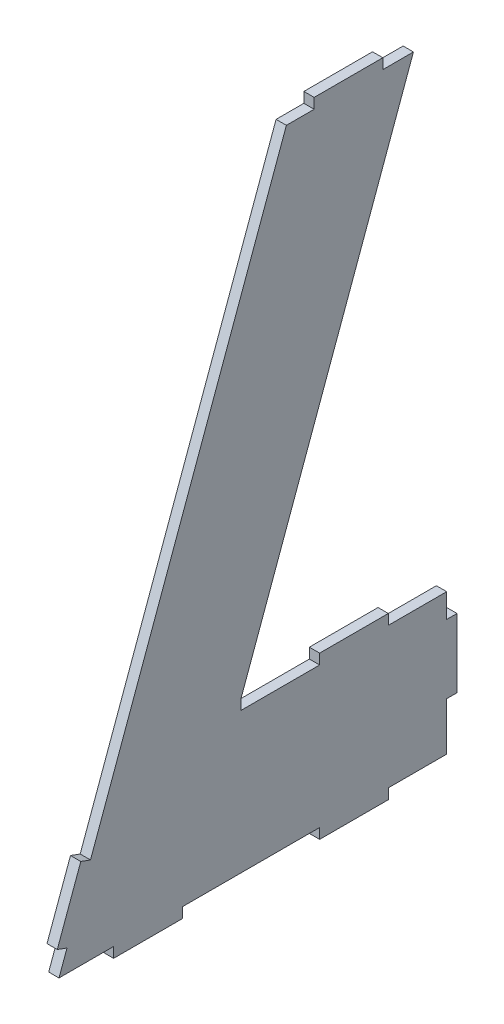
from build123d import *

# Parameters (mm, degrees)
BOSS_EXTRUDE1_DEPTH = 3
CUT_EXTRUDE1_DEPTH  = 267.131484195
SKETCH3_W           = 29.976768642
SKETCH3_H           = 52.268511193
CUT_EXTRUDE2_DEPTH  = 233.651187464
SKETCH5_W           = 11.091910703
SKETCH5_H           = 3
SKETCH5_W_2         = 10
CUT_EXTRUDE4_DEPTH  = 224.001992956
SKETCH6_W           = 20
SKETCH6_H           = 3
CUT_EXTRUDE5_DEPTH  = 224.001992956
SKETCH7_W           = 40
SKETCH7_H           = 3
CUT_EXTRUDE6_DEPTH  = 224.001992956
SKETCH8_W           = 20
SKETCH8_H           = 3
SKETCH8_W_2         = 22.898992834
CUT_EXTRUDE7_DEPTH  = 224.001992956
SKETCH10_W          = 3
SKETCH10_H          = 7
SKETCH10_H_2        = 13.984631039
CUT_EXTRUDE9_DEPTH  = 224.001992956
CUT_EXTRUDE10_REACH = 225.002
SKETCH12_W          = 3
SKETCH12_H          = 20
BOSS_EXTRUDE2_DEPTH = 3


with BuildPart() as part:
    # Sketch1 → Boss-Extrude1 (new body)
    with BuildSketch(Plane(origin=(0, 0, 0), x_dir=(0, 0, -1), z_dir=(1, 0, 0))):
        Polygon((0, 0), (120, 0), (188.404028665, 187.938524157), (68.404028665, 187.938524157), align=None)
    extrude(amount=BOSS_EXTRUDE1_DEPTH)

    # Sketch2 → Cut-Extrude1 (cut, through all)
    with BuildSketch(Plane(origin=(3, 0, 0), x_dir=(0, 0, -1), z_dir=(1, 0, 0))):
        Polygon((188.404028665, 187.938524157), (137.101007166, 46.984631039), (57.101007166, 46.984631039), (108.404028665, 187.938524157), align=None)
    extrude(amount=-CUT_EXTRUDE1_DEPTH, mode=Mode.SUBTRACT)

    # Sketch3 → Cut-Extrude2 (cut, through all)
    with BuildSketch(Plane(origin=(3, 0, 0), x_dir=(0, 0, -1), z_dir=(1, 0, 0))):
        with Locations((134.988384321, 26.134255597)):
            Rectangle(SKETCH3_W, SKETCH3_H)
    extrude(amount=-CUT_EXTRUDE2_DEPTH, mode=Mode.SUBTRACT)

    # Sketch5 → Cut-Extrude4 (cut, through all)
    with BuildSketch(Plane(origin=(3, 0, 0), x_dir=(0, 0, -1), z_dir=(1, 0, 0))):
        with Locations((72.858073314, 186.438524157)):
            Rectangle(SKETCH5_W, SKETCH5_H)
        with Locations((103.404028665, 186.438524157)):
            Rectangle(SKETCH5_W_2, SKETCH5_H)
    extrude(amount=-CUT_EXTRUDE4_DEPTH, mode=Mode.SUBTRACT)

    # Sketch6 → Cut-Extrude5 (cut, through all)
    with BuildSketch(Plane(origin=(3, 0, 0), x_dir=(0, 0, -1), z_dir=(1, 0, 0))):
        with Locations((110, 1.5)):
            Rectangle(SKETCH6_W, SKETCH6_H)
        with Locations((10, 1.5)):
            Rectangle(SKETCH6_W, SKETCH6_H)
    extrude(amount=-CUT_EXTRUDE5_DEPTH, mode=Mode.SUBTRACT)

    # Sketch7 → Cut-Extrude6 (cut, through all)
    with BuildSketch(Plane(origin=(3, 0, 0), x_dir=(0, 0, -1), z_dir=(1, 0, 0))):
        with Locations((60, 1.5)):
            Rectangle(SKETCH7_W, SKETCH7_H)
    extrude(amount=-CUT_EXTRUDE6_DEPTH, mode=Mode.SUBTRACT)

    # Sketch8 → Cut-Extrude7 (cut, through all)
    with BuildSketch(Plane(origin=(3, 0, 0), x_dir=(0, 0, -1), z_dir=(1, 0, 0))):
        with Locations((110, 45.484631039)):
            Rectangle(SKETCH8_W, SKETCH8_H)
        with Locations((68.550503583, 45.484631039)):
            Rectangle(SKETCH8_W_2, SKETCH8_H)
    extrude(amount=-CUT_EXTRUDE7_DEPTH, mode=Mode.SUBTRACT)

    # Sketch10 → Cut-Extrude9 (cut, through all)
    with BuildSketch(Plane(origin=(3, 0, 0), x_dir=(0, 0, -1), z_dir=(1, 0, 0))):
        with Locations((118.5, 40.484631039)):
            Rectangle(SKETCH10_W, SKETCH10_H)
        with Locations((118.5, 9.992315519)):
            Rectangle(SKETCH10_W, SKETCH10_H_2)
    extrude(amount=-CUT_EXTRUDE9_DEPTH, mode=Mode.SUBTRACT)

    # Sketch11 → Cut-Extrude10 (cut, up to next)
    with BuildSketch(Plane.ZY, mode=Mode.PRIVATE) as cut_extrude10_sk1:
        Polygon((-67.312117962, 184.938524157), (-1.091910703, 3), (-4.091910703, 3), (-70.312117962, 184.938524157), align=None)
    cut_extrude10_tool1 = extrude(cut_extrude10_sk1.sketch, amount=-CUT_EXTRUDE10_REACH, mode=Mode.PRIVATE) & part.part
    add(cut_extrude10_tool1.solids().sort_by_distance((0, 93.969262, -35.702014))[0], mode=Mode.SUBTRACT)

    # Sketch12 → Boss-Extrude2 (add)
    with BuildSketch(Plane(origin=(0, -0.964181415, -2.649066665), x_dir=(1, 0, 0), z_dir=(0, 0.34202014332566577, 0.9396926207859095))):
        with Locations((1.5, 21.02606043)):
            Rectangle(SKETCH12_W, SKETCH12_H)
    extrude(amount=BOSS_EXTRUDE2_DEPTH)


solid = part.part
